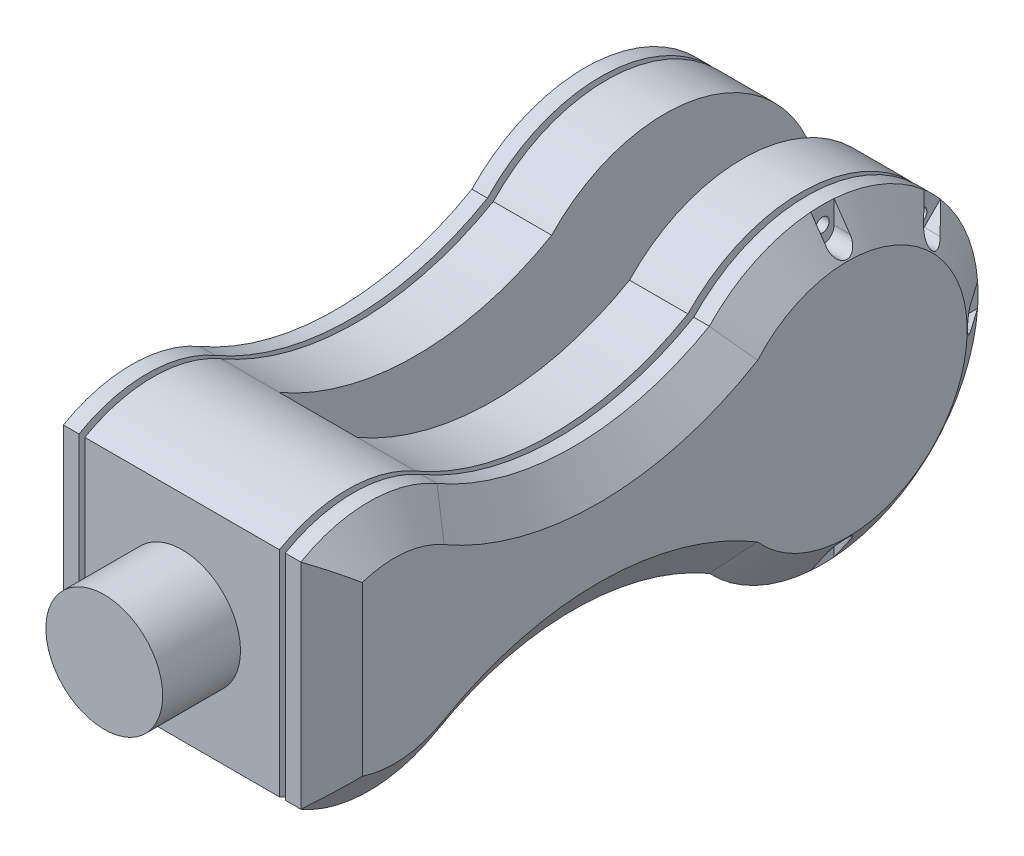
from build123d import *

# Parameters (mm, degrees)
SKETCH2_W                       = 10
SKETCH2_H                       = 27.5
BOSS_EXTRUDE1_DEPTH             = 1
BOSS_EXTRUDE3_DEPTH             = 15
BOSS_EXTRUDE5_DEPTH             = 1.5
BOSS_EXTRUDE6_DEPTH             = 4
BOSS_EXTRUDE7_DEPTH             = 6.5
BOSS_EXTRUDE7_DRAFT             = 55
CUT_EXTRUDE1_DEPTH              = 6.5
SKETCH9_R                       = 1.75
CUT_EXTRUDE2_DEPTH              = 5
CIRPATTERN1_COUNT               = 3
CIRPATTERN1_ANGLE               = 90
CIRPATTERN1_THE_OTHER_WAY_COUNT = 3
CIRPATTERN1_THE_OTHER_WAY_ANGLE = 90
BOSS_EXTRUDE8_START             = 10
BOSS_EXTRUDE8_DEPTH             = 10
SKETCH11_R                      = 15
BOSS_EXTRUDE9_DEPTH             = 20
SKETCH12_R                      = 10
CUT_EXTRUDE3_DEPTH              = 15
CUT_EXTRUDE4_START              = -15
SKETCH13_R                      = 10
CUT_EXTRUDE4_DEPTH              = 15


with BuildPart() as part:
    # Sketch2 → Boss-Extrude1 (new body)
    with BuildSketch(Plane.XY):
        with Locations((5, 13.75)):
            Rectangle(SKETCH2_W, SKETCH2_H)
    extrude(amount=BOSS_EXTRUDE1_DEPTH)

    # Sketch3 → Boss-Extrude3 (add)
    with BuildSketch(Plane(origin=(10, 0, 0), x_dir=(0, 0, -1), z_dir=(1, 0, 0))):
        with BuildLine():
            Line((-1, 27.5), (-1, -27.5))
            ThreePointArc((-1, -27.5), (16.492104151, -32.184553568), (33.984208301, -27.5))
            ThreePointArc((33.984208301, -27.5), (68.968416602, -18.130892864), (103.952624903, -27.5))
            ThreePointArc((103.952624903, -27.5), (173, 0), (103.952624903, 27.5))
            ThreePointArc((103.952624903, 27.5), (68.968416602, 18.130892864), (33.984208301, 27.5))
            ThreePointArc((33.984208301, 27.5), (16.492104151, 32.184553568), (-1, 27.5))
        make_face()
    extrude(amount=BOSS_EXTRUDE3_DEPTH)

    # Sketch4 → Boss-Extrude5 (add)
    with BuildSketch(Plane(origin=(25, 0, 0), x_dir=(0, 0, -1), z_dir=(1, 0, 0))):
        with BuildLine():
            Line((1.5, 26.020066623), (1.5, -26.020066623))
            ThreePointArc((1.5, -26.020066623), (17.205153894, -29.676730473), (32.73477229, -25.334610969))
            ThreePointArc((32.73477229, -25.334610969), (69.155140131, -15.631133318), (105.525042417, -25.52208271))
            ThreePointArc((105.525042417, -25.52208271), (170.5, 0), (105.525042417, 25.52208271))
            ThreePointArc((105.525042417, 25.52208271), (69.155140131, 15.631133318), (32.73477229, 25.334610969))
            ThreePointArc((32.73477229, 25.334610969), (17.205153894, 29.676730473), (1.5, 26.020066623))
        make_face()
    extrude(amount=BOSS_EXTRUDE5_DEPTH)

    # Sketch5 → Boss-Extrude6 (add)
    with BuildSketch(Plane(origin=(26.5, 0, 0), x_dir=(0, 0, -1), z_dir=(1, 0, 0))):
        with BuildLine():
            Line((-1, 27.5), (-1, -27.5))
            ThreePointArc((-1, -27.5), (16.492104151, -32.184553568), (33.984208301, -27.5))
            ThreePointArc((33.984208301, -27.5), (68.968416602, -18.130892864), (103.952624903, -27.5))
            ThreePointArc((103.952624903, -27.5), (173, 0), (103.952624903, 27.5))
            ThreePointArc((103.952624903, 27.5), (68.968416602, 18.130892864), (33.984208301, 27.5))
            ThreePointArc((33.984208301, 27.5), (16.492104151, 32.184553568), (-1, 27.5))
        make_face()
    extrude(amount=BOSS_EXTRUDE6_DEPTH)


with BuildPart() as boss_extrude7_tool:
    # Sketch6 → Boss-Extrude7 (with draft: the straight prism first)
    with BuildSketch(Plane(origin=(30.5, 0, 0), x_dir=(0, 0, -1), z_dir=(1, 0, 0))):
        with BuildLine():
            Line((-1, 27.5), (-1, -27.5))
            ThreePointArc((-1, -27.5), (16.492104151, -32.184553568), (33.984208301, -27.5))
            ThreePointArc((33.984208301, -27.5), (68.968416602, -18.130892864), (103.952624903, -27.5))
            ThreePointArc((103.952624903, -27.5), (173, 0), (103.952624903, 27.5))
            ThreePointArc((103.952624903, 27.5), (68.968416602, 18.130892864), (33.984208301, 27.5))
            ThreePointArc((33.984208301, 27.5), (16.492104151, 32.184553568), (-1, 27.5))
        make_face()
    extrude(amount=BOSS_EXTRUDE7_DEPTH)
    # Boss-Extrude7: the draft: its side faces are tilted about the plane it starts from
    boss_extrude7_sides = [boss_extrude7_tool.faces().sort_by_distance(p)[0] for p in [
        (33.75, 32.184553568, -16.492104151),
        (33.75, 0, 1),
        (33.75, -32.184553568, -16.492104151),
        (33.75, -18.130892864, -68.968416602),
        (33.75, 0, -173),
        (33.75, 18.130892864, -68.968416602),
    ]]
    draft(boss_extrude7_sides, Plane(origin=(30.5, 0, 0), x_dir=(0, 0, -1), z_dir=(1, 0, 0)), BOSS_EXTRUDE7_DRAFT)


with BuildPart() as part_1:
    add(part.part)

    # Boss-Extrude7: add boss_extrude7_tool
    add(boss_extrude7_tool.part)

    # Sketch8 → Cut-Extrude1 (cut)
    with BuildSketch(Plane(origin=(37, 0, 0), x_dir=(0, 0, -1), z_dir=(1, 0, 0))):
        with BuildLine():
            Line((173, 3), (167, 3))
            ThreePointArc((167, 3), (164, 0), (167, -3))
            Line((167, -3), (173, -3))
            ThreePointArc((173, -3), (174, 0), (173, 3))
        make_face()
    cut_extrude1 = extrude(amount=-CUT_EXTRUDE1_DEPTH, mode=Mode.SUBTRACT)

    # Sketch9 → Cut-Extrude2 (cut)
    with BuildSketch(Plane(origin=(30.5, 0, 0), x_dir=(0, 0, -1), z_dir=(1, 0, 0))):
        with Locations((168.5, 0)):
            Circle(SKETCH9_R)
    cut_extrude2 = extrude(amount=-CUT_EXTRUDE2_DEPTH, mode=Mode.SUBTRACT)

    # CirPattern1: Cut-Extrude1, Cut-Extrude2 ×3 about axis
    cirpattern1_axis = Axis((0, 0, -133), (1, 0, 0))
    add([cut_extrude1.rotate(cirpattern1_axis, i * CIRPATTERN1_ANGLE / (CIRPATTERN1_COUNT - 1)) for i in range(1, CIRPATTERN1_COUNT)], mode=Mode.SUBTRACT)
    add([cut_extrude2.rotate(cirpattern1_axis, i * CIRPATTERN1_ANGLE / (CIRPATTERN1_COUNT - 1)) for i in range(1, CIRPATTERN1_COUNT)], mode=Mode.SUBTRACT)

    # CirPattern1 the other way: Cut-Extrude1, Cut-Extrude2 ×3 about axis
    cirpattern1_the_other_way_axis = Axis((0, 0, -133), (-1, 0, 0))
    add([cut_extrude1.rotate(cirpattern1_the_other_way_axis, i * CIRPATTERN1_THE_OTHER_WAY_ANGLE / (CIRPATTERN1_THE_OTHER_WAY_COUNT - 1)) for i in range(1, CIRPATTERN1_THE_OTHER_WAY_COUNT)], mode=Mode.SUBTRACT)
    add([cut_extrude2.rotate(cirpattern1_the_other_way_axis, i * CIRPATTERN1_THE_OTHER_WAY_ANGLE / (CIRPATTERN1_THE_OTHER_WAY_COUNT - 1)) for i in range(1, CIRPATTERN1_THE_OTHER_WAY_COUNT)], mode=Mode.SUBTRACT)

    # Sketch10 → Boss-Extrude8 (add)
    with BuildSketch(Plane.ZY.offset(-10).offset(BOSS_EXTRUDE8_START)):
        with BuildLine():
            Line((-33.984208301, 27.5), (-33.984208301, -27.5))
            ThreePointArc((-33.984208301, -27.5), (-16.492104151, -32.184553568), (1, -27.5))
            Line((1, -27.5), (1, 0))
            Line((1, 0), (0, 0))
            Line((0, 0), (0, 27.5))
            Line((0, 27.5), (1, 27.5))
            ThreePointArc((1, 27.5), (-16.492104151, 32.184553568), (-33.984208301, 27.5))
        make_face()
    extrude(amount=-BOSS_EXTRUDE8_DEPTH)

    # Mirror1: part across plane


with BuildPart() as part_2:
    add(part_1.part)
    add(part_1.part.mirror(Plane(origin=(0, 0, 1), x_dir=(0, 0, 1), z_dir=(1, 0, 0))))

    # Sketch11 → Boss-Extrude9 (add)
    with BuildSketch(Plane.XY.offset(1)):
        Circle(SKETCH11_R)
    extrude(amount=BOSS_EXTRUDE9_DEPTH)

    # Sketch12 → Cut-Extrude3 (cut)
    with BuildSketch(Plane.ZY.offset(-10)):
        with Locations((-133, 0)):
            Circle(SKETCH12_R)
    extrude(amount=-CUT_EXTRUDE3_DEPTH, mode=Mode.SUBTRACT)

    # Sketch13 → Cut-Extrude4 (cut)
    with BuildSketch(Plane(origin=(-10, 0, 0), x_dir=(0, 0, -1), z_dir=(1, 0, 0)).offset(CUT_EXTRUDE4_START)):
        with Locations(Location((133, 0, 0), (0, 0, 180))):
            Circle(SKETCH13_R)
    extrude(amount=CUT_EXTRUDE4_DEPTH, mode=Mode.SUBTRACT)


solid = part_2.part
